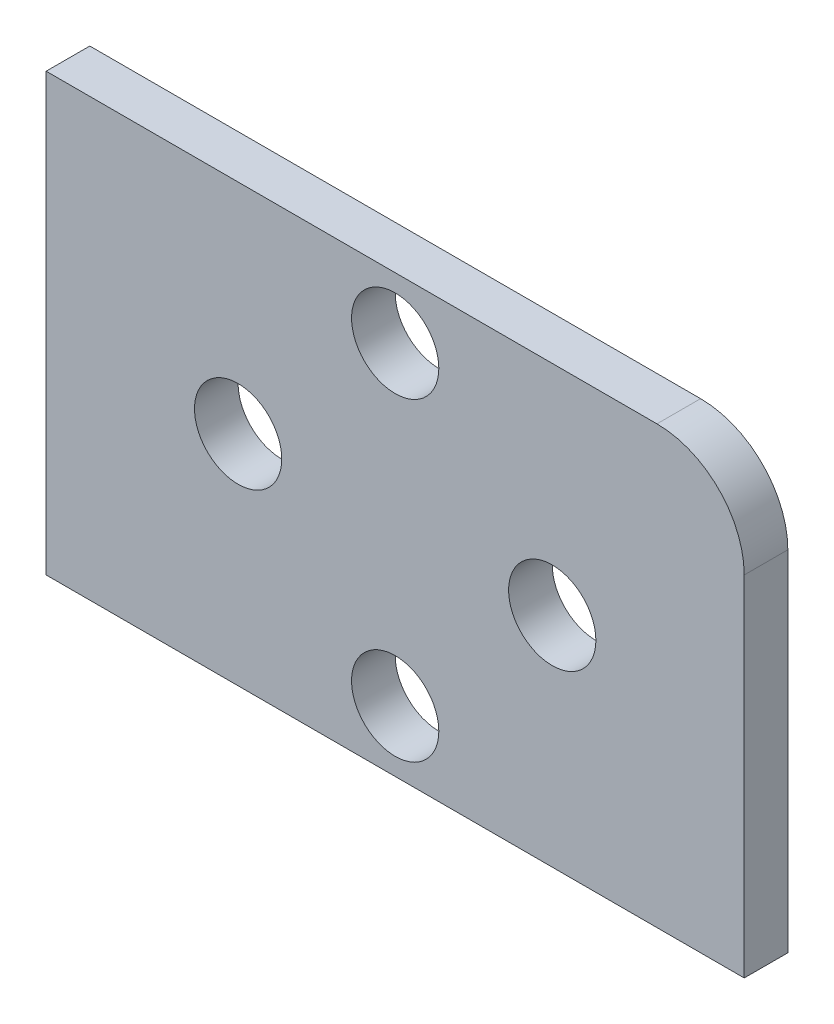
from build123d import *

# Parameters (mm, degrees)
SKETCH2_W           = 80
SKETCH2_H           = 50
BOSS_EXTRUDE1_DEPTH = 5
SKETCH3_R           = 5
CUT_EXTRUDE1_DEPTH  = 5
FILLET1_R           = 10


with BuildPart() as part:
    # Sketch2 → Boss-Extrude1 (new body)
    with BuildSketch(Plane.XY):
        Rectangle(SKETCH2_W, SKETCH2_H)
    extrude(amount=-BOSS_EXTRUDE1_DEPTH)

    # Sketch3 → Cut-Extrude1 (cut)
    with BuildSketch(Plane.XY):
        with Locations((-18, 0)):
            Circle(SKETCH3_R)
        with Locations((0, 18)):
            Circle(SKETCH3_R)
        with Locations((18, 0)):
            Circle(SKETCH3_R)
        with Locations((0, -18)):
            Circle(SKETCH3_R)
    extrude(amount=-CUT_EXTRUDE1_DEPTH, mode=Mode.SUBTRACT)

    # Fillet1
    fillet1_edges = [part.edges().sort_by_distance(p)[0] for p in [
        (40, 25, -2.5),
    ]]
    fillet(fillet1_edges, radius=FILLET1_R)


solid = part.part
